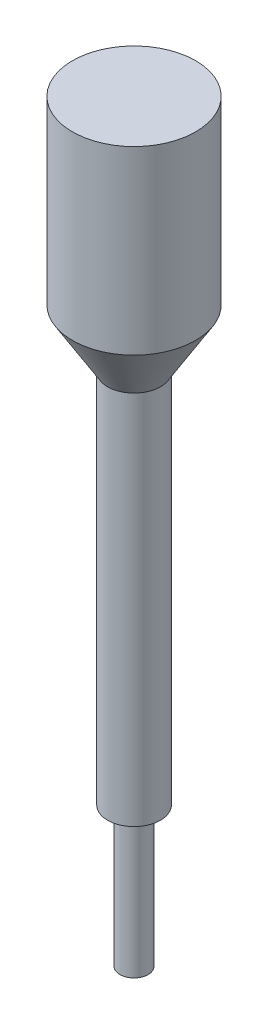
from build123d import *


with BuildPart() as part:
    # Croquis1 → Revolución1 (revolve)
    with BuildSketch(Plane.YZ, mode=Mode.PRIVATE) as revoluci_n1_sk:
        Polygon((-146.720957083, 7.5), (-146.720957083, 4), (-186.420957083, 4), (-186.420957083, 0), (27.579042917, 0), (27.579042917, 17.5), (-23.720957083, 17.5), (-40.120957083, 7.5), align=None)
    revolve(revoluci_n1_sk.sketch.rotate(Axis((0, -186.420957083, 0), (0, 1, 0)), 180), axis=Axis((0, -186.420957083, 0), (0, 1, 0)))


solid = part.part
